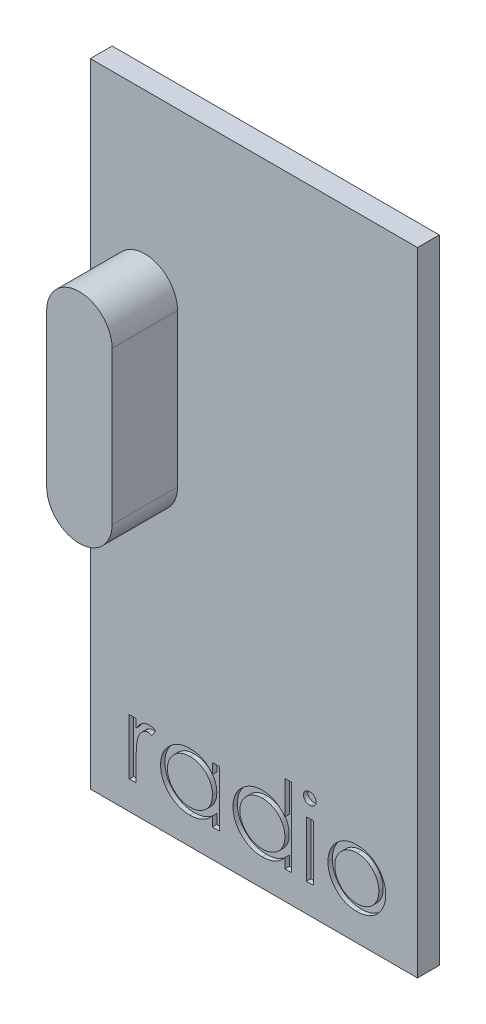
from build123d import *

# Parameters (mm, degrees)
SKETCH1_W           = 15
SKETCH1_H           = 29
BOSS_EXTRUDE1_DEPTH = 1
BOSS_EXTRUDE2_DEPTH = 3
SKETCH3_W           = 0.314102564
SKETCH3_H           = 2.557692308
CUT_EXTRUDE1_DEPTH  = 0.2


with BuildPart() as part:
    # Sketch1 → Boss-Extrude1 (new body)
    with BuildSketch(Plane.XY):
        with Locations((7.5, 14.5)):
            Rectangle(SKETCH1_W, SKETCH1_H)
    extrude(amount=BOSS_EXTRUDE1_DEPTH)

    # Sketch2 → Boss-Extrude2 (add)
    with BuildSketch(Plane.XY.offset(1)):
        with BuildLine():
            Line((1, 21), (1, 14))
            ThreePointArc((1, 14), (2.5, 12.5), (4, 14))
            Line((4, 14), (4, 21))
            ThreePointArc((4, 21), (2.5, 22.5), (1, 21))
        make_face()
    extrude(amount=BOSS_EXTRUDE2_DEPTH)

    # Sketch3 → Cut-Extrude1 (cut)
    # profile 1 of 6: a face of its own
    with BuildSketch(Plane.XY.offset(1)):
        with BuildLine():
            Line((1.785547058, 3.851020907), (2.099649622, 3.851020907))
            Line((2.099649622, 3.851020907), (2.099649622, 3.474518503))
            add(Edge.make_bspline(
                [(2.099649622, 3.474518503), (2.12283838, 3.509574331), (2.167186701, 3.57661833), (2.240899631, 3.665287631), (2.316402962, 3.738702678), (2.394058149, 3.797206197), (2.474436249, 3.841019316), (2.555773201, 3.873112351), (2.639348671, 3.892089666), (2.695510595, 3.894623325), (2.723648019, 3.895892701)],
                knots=[0, 0, 0, 0, 1.2804753, 2.448899062, 3.506932113, 4.484331642, 5.4025378, 6.288909075, 7.142734305, 8, 8, 8, 8], degree=3))
            add(Edge.make_bspline(
                [(2.723648019, 3.895892701), (2.745474346, 3.894702175), (2.790383431, 3.892252589), (2.858366021, 3.875041764), (2.928409472, 3.847563742), (2.97355186, 3.821723519), (2.997085519, 3.808252477)],
                knots=[0, 0, 0, 0, 0.901110191, 1.854092781, 2.881294221, 4, 4, 4, 4], degree=3))
            Line((2.997085519, 3.808252477), (2.824609558, 3.536217221))
            add(Edge.make_bspline(
                [(2.824609558, 3.536217221), (2.809500536, 3.542957487), (2.780820722, 3.555751802), (2.738866156, 3.570893812), (2.700184819, 3.579809728), (2.67554126, 3.581160446), (2.664052667, 3.581790137)],
                knots=[0, 0, 0, 0, 1.180555205, 2.24091978, 3.179933427, 4, 4, 4, 4], degree=3))
            add(Edge.make_bspline(
                [(2.664052667, 3.581790137), (2.638846933, 3.5801101), (2.587434543, 3.576683311), (2.511950044, 3.549744503), (2.438702838, 3.506219263), (2.380531176, 3.457948151), (2.335488923, 3.411400353), (2.303348697, 3.370751951), (2.27386595, 3.325173319), (2.24569573, 3.275443636), (2.220029436, 3.22071379), (2.196074767, 3.161530576), (2.174415904, 3.097825447), (2.162065659, 3.053442927), (2.155739365, 3.030708407)],
                knots=[0, 0, 0, 0, 1.125678352, 2.296057538, 3.5422874, 4.923748041, 5.663163013, 6.437101912, 7.23742474, 8.08941207, 8.991984279, 9.93940061, 10.944477711, 12, 12, 12, 12], degree=3))
            add(Edge.make_bspline(
                [(2.155739365, 3.030708407), (2.151006972, 3.010431233), (2.14052508, 2.965518834), (2.130333542, 2.89017031), (2.120264024, 2.801146651), (2.113167406, 2.698200058), (2.106589364, 2.581587614), (2.102879282, 2.451131668), (2.099776141, 2.306698317), (2.099693074, 2.205723964), (2.099649622, 2.152903919)],
                knots=[0, 0, 0, 0, 0.566838948, 1.255505196, 2.06880316, 3.007127437, 4.065329342, 5.249902469, 6.561414163, 8, 8, 8, 8], degree=3))
            Line((2.099649622, 2.152903919), (2.099649622, 1.293328599))
            Line((2.099649622, 1.293328599), (1.785547058, 1.293328599))
            Line((1.785547058, 1.293328599), (1.785547058, 3.851020907))
        make_face()
    # profile 2 of 6: a face of its own
    with BuildSketch(Plane.XY.offset(1)):
        with BuildLine():
            Line((5.913752186, 3.851020907), (5.913752186, 1.293328599))
            Line((5.913752186, 1.293328599), (5.599649622, 1.293328599))
            Line((5.599649622, 1.293328599), (5.599649622, 1.735736451))
            add(Edge.make_bspline(
                [(5.599649622, 1.735736451), (5.564230831, 1.695696857), (5.495110616, 1.617559086), (5.379669498, 1.515476914), (5.25730132, 1.431098592), (5.128599999, 1.362948677), (4.993681755, 1.31175662), (4.852845668, 1.275370461), (4.706034287, 1.251976626), (4.605781932, 1.249640604), (4.554978147, 1.248456804)],
                knots=[0, 0, 0, 0, 1.074387032, 2.096679803, 3.090159297, 4.057316773, 5.018401886, 5.985159533, 6.978961417, 8, 8, 8, 8], degree=3))
            add(Edge.make_bspline(
                [(4.554978147, 1.248456804), (4.509810193, 1.249683176), (4.420736989, 1.252101637), (4.289707911, 1.27086394), (4.163615662, 1.300994562), (4.042341089, 1.342895451), (3.926668944, 1.398476273), (3.815608847, 1.465017521), (3.709736155, 1.544258351), (3.610664616, 1.63484638), (3.519432616, 1.733241367), (3.439371343, 1.838186914), (3.372618263, 1.949229217), (3.316798183, 2.064962371), (3.273801838, 2.186277291), (3.243828204, 2.312754459), (3.225087757, 2.444244332), (3.222670297, 2.533783855), (3.221444493, 2.579185971)],
                knots=[0, 0, 0, 0, 1.033919861, 2.038935746, 3.024066025, 3.998881131, 4.97069526, 5.957263378, 6.95902576, 7.993208707, 9.027059324, 10.027763471, 11.009749337, 11.988697705, 12.965288445, 13.950418724, 14.960734635, 16, 16, 16, 16], degree=3))
            add(Edge.make_bspline(
                [(3.221444493, 2.579185971), (3.222697465, 2.623649674), (3.225174522, 2.711552018), (3.243627741, 2.840830716), (3.27465875, 2.965348976), (3.318206598, 3.084705919), (3.374048553, 3.19904597), (3.44197664, 3.308449995), (3.521995764, 3.413219392), (3.614248172, 3.510890619), (3.714182942, 3.601111233), (3.821091673, 3.679520279), (3.932314954, 3.747237127), (4.049577964, 3.800890604), (4.171145069, 3.844299708), (4.298098515, 3.874332676), (4.429910094, 3.892029998), (4.519400586, 3.894592762), (4.564793852, 3.895892701)],
                knots=[0, 0, 0, 0, 1.020392517, 2.01726096, 2.990465484, 3.961182959, 4.928053699, 5.906110375, 6.912531644, 7.948652711, 8.985773172, 9.998621852, 10.987621588, 11.969261332, 12.953316658, 13.946091881, 14.958173133, 16, 16, 16, 16], degree=3))
            add(Edge.make_bspline(
                [(4.564793852, 3.895892701), (4.616993711, 3.89445495), (4.719355171, 3.891635587), (4.869083181, 3.86817286), (5.010727659, 3.828534392), (5.145382011, 3.774616894), (5.272562697, 3.702968165), (5.391065681, 3.612588204), (5.502131164, 3.504047017), (5.566511456, 3.420676573), (5.599649622, 3.377763695)],
                knots=[0, 0, 0, 0, 1.038897134, 2.037228247, 3.008116434, 3.962042015, 4.918381754, 5.904844433, 6.921570401, 8, 8, 8, 8], degree=3))
            Line((5.599649622, 3.377763695), (5.599649622, 3.851020907))
            Line((5.599649622, 3.851020907), (5.913752186, 3.851020907))
        make_face()
        with BuildLine():
            add(Edge.make_bspline(
                [(4.569000583, 3.581790137), (4.523086245, 3.5801565), (4.432458645, 3.576931959), (4.299414643, 3.551758463), (4.172101229, 3.509873869), (4.051155155, 3.452591968), (3.938486938, 3.380563231), (3.837793267, 3.293441848), (3.748250566, 3.193604834), (3.672942302, 3.081502723), (3.611551805, 2.961324632), (3.568384773, 2.835700194), (3.539915526, 2.706895217), (3.537007005, 2.619532531), (3.535547058, 2.575680362)],
                knots=[0, 0, 0, 0, 1.031046209, 2.035121221, 3.029706178, 4.034933723, 5.034054252, 6.02443088, 7.017295772, 8.038157696, 9.050218397, 10.03989886, 11.016116709, 12, 12, 12, 12], degree=3))
            add(Edge.make_bspline(
                [(3.535547058, 2.575680362), (3.537411951, 2.532090254), (3.541134428, 2.445080899), (3.567885122, 2.316100322), (3.612764996, 2.19044628), (3.674007058, 2.069185286), (3.750693683, 1.956601186), (3.839582336, 1.854861063), (3.941532617, 1.767371475), (4.054460124, 1.694133901), (4.175068094, 1.634971381), (4.301902026, 1.593805741), (4.432577664, 1.56722796), (4.521429998, 1.564123484), (4.566196096, 1.562559368)],
                knots=[0, 0, 0, 0, 0.979072187, 1.954306742, 2.945804271, 3.96968567, 4.997920485, 5.998718438, 6.996577872, 8.005894225, 9.015743152, 10.005417472, 10.995077863, 12, 12, 12, 12], degree=3))
            add(Edge.make_bspline(
                [(4.566196096, 1.562559368), (4.611642599, 1.564219332), (4.702031185, 1.567520836), (4.835469893, 1.592802101), (4.964964856, 1.634570899), (5.088752084, 1.692470026), (5.204068215, 1.764227382), (5.307566093, 1.848234473), (5.395082061, 1.945937657), (5.469274671, 2.05331411), (5.527450088, 2.171026107), (5.569826147, 2.296360297), (5.594880053, 2.429321045), (5.598037782, 2.520184972), (5.599649622, 2.566565778)],
                knots=[0, 0, 0, 0, 1.01762866, 2.023962475, 3.030623092, 4.058876274, 5.077231937, 6.066672613, 7.034107872, 8.005628644, 8.981990164, 9.965428785, 10.961468474, 12, 12, 12, 12], degree=3))
            add(Edge.make_bspline(
                [(5.599649622, 2.566565778), (5.598689965, 2.601903609), (5.596801058, 2.671459642), (5.582370488, 2.77358716), (5.559415562, 2.871320886), (5.527069392, 2.964763575), (5.484578107, 3.05339859), (5.433330342, 3.13786235), (5.372424892, 3.217715562), (5.302842196, 3.291858633), (5.226676993, 3.359485095), (5.146082453, 3.419849336), (5.060103706, 3.469438109), (4.970186669, 3.51047938), (4.876175334, 3.54313853), (4.777304714, 3.564926224), (4.674625727, 3.579886545), (4.604579672, 3.581148925), (4.569000583, 3.581790137)],
                knots=[0, 0, 0, 0, 1.050140795, 2.067009409, 3.05949893, 4.030605086, 5.00011959, 5.97591094, 6.962425594, 7.979863591, 8.993523472, 9.986985069, 10.967611495, 11.937549037, 12.921786183, 13.919465291, 14.943216303, 16, 16, 16, 16], degree=3))
        make_face(mode=Mode.SUBTRACT)
    # profile 3 of 6: a face of its own
    with BuildSketch(Plane.XY.offset(1)):
        with BuildLine():
            Line((9.234265006, 4.883072189), (9.234265006, 1.293328599))
            Line((9.234265006, 1.293328599), (8.920162442, 1.293328599))
            Line((8.920162442, 1.293328599), (8.920162442, 1.735736451))
            add(Edge.make_bspline(
                [(8.920162442, 1.735736451), (8.884743652, 1.695696857), (8.815623436, 1.617559086), (8.700182318, 1.515476914), (8.57781414, 1.431098592), (8.449112819, 1.362948677), (8.314194576, 1.31175662), (8.173358489, 1.275370461), (8.026547108, 1.251976626), (7.926294753, 1.249640604), (7.875490968, 1.248456804)],
                knots=[0, 0, 0, 0, 1.074387032, 2.096679803, 3.090159297, 4.057316773, 5.018401886, 5.985159533, 6.978961417, 8, 8, 8, 8], degree=3))
            add(Edge.make_bspline(
                [(7.875490968, 1.248456804), (7.830323014, 1.249683176), (7.741249809, 1.252101637), (7.610220732, 1.27086394), (7.484128482, 1.300994562), (7.36285391, 1.342895451), (7.247181764, 1.398476273), (7.136121668, 1.465017521), (7.030248976, 1.544258351), (6.931177437, 1.63484638), (6.839945436, 1.733241367), (6.759884164, 1.838186914), (6.693131084, 1.949229217), (6.637311003, 2.064962371), (6.594314659, 2.186277291), (6.564341024, 2.312754459), (6.545600578, 2.444244332), (6.543183117, 2.533783855), (6.541957314, 2.579185971)],
                knots=[0, 0, 0, 0, 1.033919861, 2.038935746, 3.024066025, 3.998881131, 4.97069526, 5.957263378, 6.95902576, 7.993208707, 9.027059324, 10.027763471, 11.009749337, 11.988697705, 12.965288445, 13.950418724, 14.960734635, 16, 16, 16, 16], degree=3))
            add(Edge.make_bspline(
                [(6.541957314, 2.579185971), (6.543210285, 2.623649674), (6.545687342, 2.711552018), (6.564140562, 2.840830716), (6.595171571, 2.965348976), (6.638719418, 3.084705919), (6.694561373, 3.19904597), (6.76248946, 3.308449995), (6.842508585, 3.413219392), (6.934760992, 3.510890619), (7.034695762, 3.601111233), (7.141604493, 3.679520279), (7.252827774, 3.747237127), (7.370090785, 3.800890604), (7.49165789, 3.844299708), (7.618611336, 3.874332676), (7.750422914, 3.892029998), (7.839913406, 3.894592762), (7.885306673, 3.895892701)],
                knots=[0, 0, 0, 0, 1.020392517, 2.01726096, 2.990465484, 3.961182959, 4.928053699, 5.906110375, 6.912531644, 7.948652711, 8.985773172, 9.998621852, 10.987621588, 11.969261332, 12.953316658, 13.946091881, 14.958173133, 16, 16, 16, 16], degree=3))
            add(Edge.make_bspline(
                [(7.885306673, 3.895892701), (7.937523481, 3.894325605), (8.040019271, 3.89124957), (8.189917793, 3.865543203), (8.331705403, 3.822380325), (8.466198391, 3.763289044), (8.592594951, 3.686488293), (8.711821592, 3.593736845), (8.821804915, 3.482409699), (8.886876737, 3.398798125), (8.920162442, 3.356028919)],
                knots=[0, 0, 0, 0, 1.031072012, 2.023879775, 2.993683497, 3.952812103, 4.918022106, 5.908088563, 6.929940113, 8, 8, 8, 8], degree=3))
            Line((8.920162442, 3.356028919), (8.920162442, 4.883072189))
            Line((8.920162442, 4.883072189), (9.234265006, 4.883072189))
        make_face()
        with BuildLine():
            add(Edge.make_bspline(
                [(7.889513404, 3.581790137), (7.843599066, 3.5801565), (7.752971466, 3.576931959), (7.619927464, 3.551758463), (7.49261405, 3.509873869), (7.371667975, 3.452591968), (7.258999759, 3.380563231), (7.158306088, 3.293441848), (7.068763387, 3.193604834), (6.993455122, 3.081502723), (6.932064625, 2.961324632), (6.888897594, 2.835700194), (6.860428346, 2.706895217), (6.857519826, 2.619532531), (6.856059878, 2.575680362)],
                knots=[0, 0, 0, 0, 1.031046209, 2.035121221, 3.029706178, 4.034933723, 5.034054252, 6.02443088, 7.017295772, 8.038157696, 9.050218397, 10.03989886, 11.016116709, 12, 12, 12, 12], degree=3))
            add(Edge.make_bspline(
                [(6.856059878, 2.575680362), (6.857924771, 2.532090254), (6.861647248, 2.445080899), (6.888397943, 2.316100322), (6.933277816, 2.19044628), (6.994519879, 2.069185286), (7.071206504, 1.956601186), (7.160095156, 1.854861063), (7.262045437, 1.767371475), (7.374972944, 1.694133901), (7.495580915, 1.634971381), (7.622414846, 1.593805741), (7.753090484, 1.56722796), (7.841942818, 1.564123484), (7.886708917, 1.562559368)],
                knots=[0, 0, 0, 0, 0.979072187, 1.954306742, 2.945804271, 3.96968567, 4.997920485, 5.998718438, 6.996577872, 8.005894225, 9.015743152, 10.005417472, 10.995077863, 12, 12, 12, 12], degree=3))
            add(Edge.make_bspline(
                [(7.886708917, 1.562559368), (7.932155419, 1.564219332), (8.022544006, 1.567520836), (8.155982714, 1.592802101), (8.285477676, 1.634570899), (8.409264905, 1.692470026), (8.524581036, 1.764227382), (8.628078914, 1.848234473), (8.715594882, 1.945937657), (8.789787492, 2.05331411), (8.847962908, 2.171026107), (8.890338967, 2.296360297), (8.915392873, 2.429321045), (8.918550603, 2.520184972), (8.920162442, 2.566565778)],
                knots=[0, 0, 0, 0, 1.01762866, 2.023962475, 3.030623092, 4.058876274, 5.077231937, 6.066672613, 7.034107872, 8.005628644, 8.981990164, 9.965428785, 10.961468474, 12, 12, 12, 12], degree=3))
            add(Edge.make_bspline(
                [(8.920162442, 2.566565778), (8.919202786, 2.601903609), (8.917313878, 2.671459642), (8.902883309, 2.77358716), (8.879928382, 2.871320886), (8.847582212, 2.964763575), (8.805090928, 3.05339859), (8.753843162, 3.13786235), (8.692937712, 3.217715562), (8.623355016, 3.291858633), (8.547189814, 3.359485095), (8.466595273, 3.419849336), (8.380616526, 3.469438109), (8.290699489, 3.51047938), (8.196688155, 3.54313853), (8.097817535, 3.564926224), (7.995138548, 3.579886545), (7.925092493, 3.581148925), (7.889513404, 3.581790137)],
                knots=[0, 0, 0, 0, 1.050140795, 2.067009409, 3.05949893, 4.030605086, 5.00011959, 5.97591094, 6.962425594, 7.979863591, 8.993523472, 9.986985069, 10.967611495, 11.937549037, 12.921786183, 13.919465291, 14.943216303, 16, 16, 16, 16], degree=3))
        make_face(mode=Mode.SUBTRACT)
    # profile 4 of 6: a face of its own
    with BuildSketch(Plane.XY.offset(1)):
        with BuildLine():
            add(Edge.make_bspline(
                [(10.062990968, 4.927943983), (10.082482284, 4.927039831), (10.120650023, 4.925269327), (10.175843291, 4.91010785), (10.226100303, 4.884408164), (10.270678036, 4.849928484), (10.308929923, 4.80937904), (10.335710633, 4.762118072), (10.352923029, 4.711059433), (10.355001585, 4.675444344), (10.356059878, 4.657310971)],
                knots=[0, 0, 0, 0, 1.055194115, 2.066272739, 3.074728998, 4.095836921, 5.109056067, 6.073838105, 7.019297344, 8, 8, 8, 8], degree=3))
            add(Edge.make_bspline(
                [(10.356059878, 4.657310971), (10.354977718, 4.639648317), (10.352838416, 4.604731342), (10.335723928, 4.55455787), (10.30870169, 4.507953587), (10.270702565, 4.467482877), (10.226093804, 4.433022257), (10.175845018, 4.407317518), (10.120649569, 4.39215738), (10.08248213, 4.390386692), (10.062990968, 4.389482445)],
                knots=[0, 0, 0, 0, 0.96129708, 1.900370562, 2.859976407, 3.87933698, 4.906634145, 5.921202961, 6.938410037, 8, 8, 8, 8], degree=3))
            add(Edge.make_bspline(
                [(10.062990968, 4.389482445), (10.043722693, 4.390352165), (10.006219512, 4.392044962), (9.95185267, 4.40761498), (9.902024181, 4.433031053), (9.857359508, 4.467257238), (9.820129315, 4.508202135), (9.79303099, 4.554529429), (9.775956028, 4.604738584), (9.773811399, 4.63965075), (9.772726545, 4.657310971)],
                knots=[0, 0, 0, 0, 1.054934014, 2.053291228, 3.073705704, 4.106921865, 5.123545215, 6.088680038, 7.033164197, 8, 8, 8, 8], degree=3))
            add(Edge.make_bspline(
                [(9.772726545, 4.657310971), (9.773787631, 4.67544182), (9.775871672, 4.711051953), (9.793043789, 4.762146986), (9.819903596, 4.809128488), (9.85738416, 4.850153987), (9.90201762, 4.884399422), (9.951854365, 4.909810403), (10.006219065, 4.925381743), (10.043722541, 4.927074357), (10.062990968, 4.927943983)],
                knots=[0, 0, 0, 0, 0.98631895, 1.937192651, 2.907499808, 3.917963147, 4.944918757, 5.95915025, 6.951458133, 8, 8, 8, 8], degree=3))
        make_face()
    # profile 5 of 6: a face of its own
    with BuildSketch(Plane.XY.offset(1)):
        with Locations((10.064393211, 2.572174753)):
            Rectangle(SKETCH3_W, SKETCH3_H)
    # profile 6 of 6: a face of its own
    with BuildSketch(Plane.XY.offset(1)):
        with BuildLine():
            add(Edge.make_bspline(
                [(12.219641609, 3.895892701), (12.267632882, 3.89487081), (12.361732039, 3.892867131), (12.499539925, 3.871452166), (12.631085061, 3.838704801), (12.756871253, 3.793433239), (12.875287549, 3.732751289), (12.988058793, 3.660341998), (13.094875802, 3.574559404), (13.158898831, 3.508201336), (13.191396417, 3.474518503)],
                knots=[0, 0, 0, 0, 1.054011418, 2.066658804, 3.057071809, 4.030435133, 4.997543892, 5.974964718, 6.972108034, 8, 8, 8, 8], degree=3))
            add(Edge.make_bspline(
                [(13.191396417, 3.474518503), (13.219378371, 3.442304517), (13.274800751, 3.378499975), (13.34586647, 3.275044362), (13.40708803, 3.167904261), (13.456150991, 3.055656934), (13.494836014, 2.939282263), (13.522301711, 2.818380252), (13.538638646, 2.693217905), (13.540841613, 2.608214067), (13.541957314, 2.565163535)],
                knots=[0, 0, 0, 0, 1.025258237, 2.030674902, 3.01204498, 3.988269485, 4.97094183, 5.956517959, 6.965070386, 8, 8, 8, 8], degree=3))
            add(Edge.make_bspline(
                [(13.541957314, 2.565163535), (13.540975977, 2.521863477), (13.539036808, 2.436300544), (13.520693192, 2.310281178), (13.492162106, 2.188086355), (13.451330268, 2.070227662), (13.398972159, 1.956344834), (13.335081471, 1.846935285), (13.259209854, 1.741783152), (13.173205857, 1.641781313), (13.078153981, 1.549615098), (12.975037833, 1.469286829), (12.865883799, 1.400465305), (12.749240446, 1.345028889), (12.626172959, 1.301319189), (12.496415891, 1.270619172), (12.36017082, 1.252057488), (12.267143599, 1.249673915), (12.219641609, 1.248456804)],
                knots=[0, 0, 0, 0, 0.998656419, 1.973391657, 2.932242238, 3.890759089, 4.846373663, 5.82037756, 6.809684879, 7.83454468, 8.860553229, 9.859544525, 10.845671541, 11.83227036, 12.833544569, 13.85385346, 14.904124723, 16, 16, 16, 16], degree=3))
            add(Edge.make_bspline(
                [(12.219641609, 1.248456804), (12.171906889, 1.249678), (12.07841603, 1.252069775), (11.941690048, 1.270547057), (11.811700429, 1.30130504), (11.68847183, 1.345172533), (11.571326983, 1.400467076), (11.461540486, 1.469078766), (11.358340571, 1.549638921), (11.263268586, 1.641774858), (11.177269981, 1.741784815), (11.101396973, 1.846934853), (11.037506647, 1.956344947), (10.985148443, 2.070227632), (10.94431663, 2.188086363), (10.915785537, 2.310281176), (10.897441923, 2.436300544), (10.895502754, 2.521863477), (10.894521417, 2.565163535)],
                knots=[0, 0, 0, 0, 1.099876186, 2.154163076, 3.173186993, 4.173200201, 5.163417411, 6.152872554, 7.150605724, 8.17532212, 9.198891216, 10.186952605, 11.159729845, 12.11414092, 13.071450619, 14.029093627, 15.002601286, 16, 16, 16, 16], degree=3))
            add(Edge.make_bspline(
                [(10.894521417, 2.565163535), (10.895644727, 2.607980081), (10.897868688, 2.692749483), (10.914189197, 2.817676544), (10.941547754, 2.938373933), (10.98027915, 3.054299409), (11.029794341, 3.166054845), (11.090155629, 3.273459676), (11.161946262, 3.376447476), (11.217148213, 3.440169556), (11.245082314, 3.472415137)],
                knots=[0, 0, 0, 0, 1.031353054, 2.041901799, 3.029428768, 4.008703097, 4.981709435, 5.96992636, 6.972712378, 8, 8, 8, 8], degree=3))
            add(Edge.make_bspline(
                [(11.245082314, 3.472415137), (11.277530905, 3.506390077), (11.341346769, 3.573207773), (11.448695497, 3.658740297), (11.561189318, 3.732656371), (11.680914244, 3.792132586), (11.806597102, 3.838971104), (11.938816344, 3.871536619), (12.07709186, 3.892789974), (12.171651481, 3.894848152), (12.219641609, 3.895892701)],
                knots=[0, 0, 0, 0, 1.027980169, 2.021703884, 2.998553061, 3.971491411, 4.943284454, 5.930300938, 6.949603206, 8, 8, 8, 8], degree=3))
        make_face()
        with BuildLine():
            add(Edge.make_bspline(
                [(12.218239365, 3.581790137), (12.184301754, 3.580825546), (12.117302625, 3.578921263), (12.018683041, 3.564437358), (11.923742887, 3.541489854), (11.832302042, 3.508885798), (11.74466887, 3.466786899), (11.660759468, 3.415078539), (11.580327028, 3.354445582), (11.504944964, 3.284982911), (11.435762652, 3.209103916), (11.375284676, 3.128255557), (11.323859569, 3.043749211), (11.28101941, 2.955497), (11.249112222, 2.862604586), (11.2259392, 2.766123955), (11.211468959, 2.665858538), (11.209582581, 2.59769752), (11.208623981, 2.563060169)],
                knots=[0, 0, 0, 0, 1.021534396, 2.016698045, 2.994645724, 3.958388632, 4.93408049, 5.916473867, 6.921342795, 7.962252576, 8.998418191, 10.008913653, 10.997312074, 11.973003931, 12.956656626, 13.948281152, 14.957379055, 16, 16, 16, 16], degree=3))
            add(Edge.make_bspline(
                [(11.208623981, 2.563060169), (11.210230804, 2.518308142), (11.213420049, 2.429483737), (11.239355285, 2.298672614), (11.282741565, 2.173090762), (11.341328845, 2.053474376), (11.414735063, 1.942802098), (11.50122213, 1.844130613), (11.59986183, 1.758944802), (11.709478331, 1.688263956), (11.827832649, 1.632104201), (11.95308897, 1.592305225), (12.083729664, 1.566433533), (12.173010395, 1.563862058), (12.218239365, 1.562559368)],
                knots=[0, 0, 0, 0, 1.016792936, 2.018143844, 3.017858371, 4.030088057, 5.03801393, 6.028138512, 7.003788237, 7.991172063, 8.984598303, 9.972568034, 10.972917682, 12, 12, 12, 12], degree=3))
            add(Edge.make_bspline(
                [(12.218239365, 1.562559368), (12.263465734, 1.563869648), (12.35274133, 1.566456105), (12.483200507, 1.592174925), (12.608114479, 1.632278586), (12.726345866, 1.688200795), (12.83591247, 1.75921321), (12.935261591, 1.843649587), (13.021010202, 1.943063439), (13.094343807, 2.053620968), (13.15389055, 2.17290532), (13.197073752, 2.298695792), (13.223071338, 2.429477834), (13.226252166, 2.518306165), (13.22785475, 2.563060169)],
                knots=[0, 0, 0, 0, 1.02726834, 2.027799167, 3.010890988, 4.004497153, 4.992059811, 5.971914811, 6.958719428, 7.966827853, 8.981595046, 9.981490638, 10.983022906, 12, 12, 12, 12], degree=3))
            add(Edge.make_bspline(
                [(13.22785475, 2.563060169), (13.22689648, 2.597697727), (13.225010751, 2.665859153), (13.210535786, 2.766121606), (13.187380247, 2.862613203), (13.155408629, 2.955465206), (13.112754616, 3.043977711), (13.060337822, 3.128007438), (13.000106797, 3.209383984), (12.930089676, 3.284737624), (12.854786298, 3.354472661), (12.77432126, 3.41510205), (12.690536282, 3.466559646), (12.603157699, 3.509245886), (12.511705131, 3.541193227), (12.416898002, 3.564569858), (12.318699192, 3.578860055), (12.251940149, 3.580807196), (12.218239365, 3.581790137)],
                knots=[0, 0, 0, 0, 1.042956736, 2.052379634, 3.044323526, 4.02829302, 5.004299113, 5.996692471, 7.007513377, 8.048758398, 9.090003419, 10.095195979, 11.07790575, 12.047570684, 13.018257071, 13.989683339, 14.985167495, 16, 16, 16, 16], degree=3))
        make_face(mode=Mode.SUBTRACT)
    extrude(amount=-CUT_EXTRUDE1_DEPTH, mode=Mode.SUBTRACT)


solid = part.part
